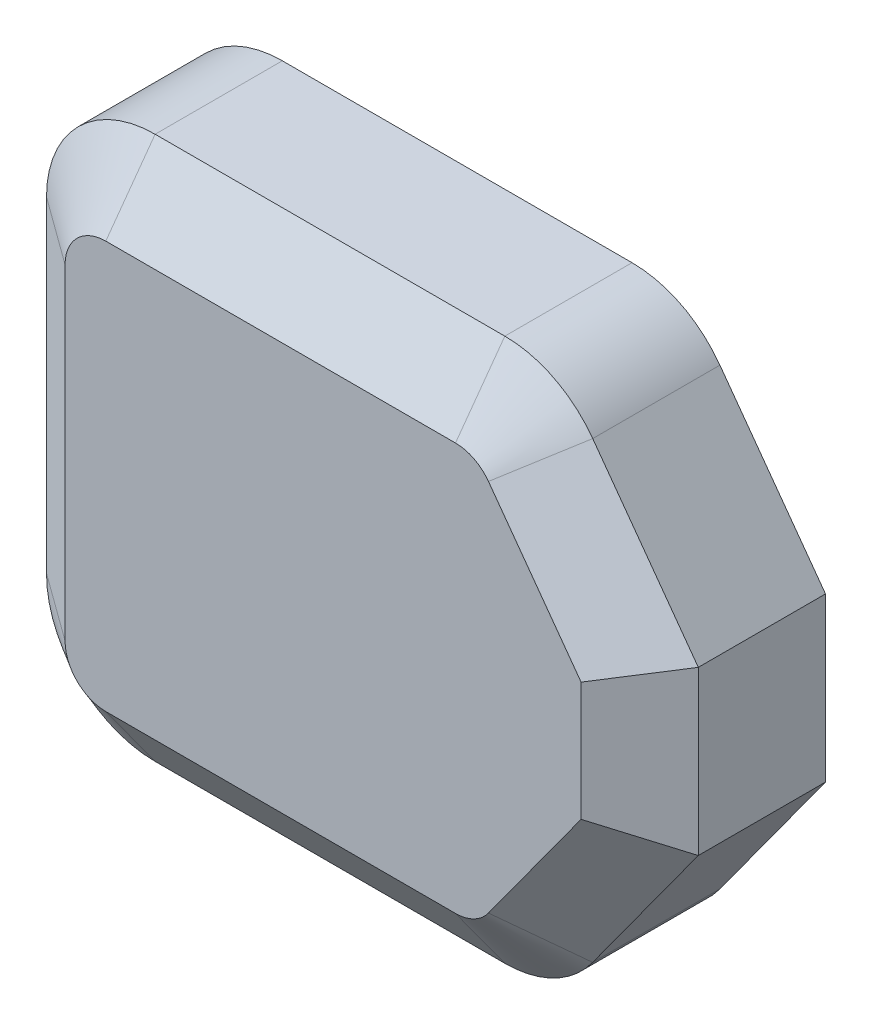
from build123d import *

# Parameters (mm, degrees)
ESQUISSE1_W        = 48
ESQUISSE1_H        = 40
BOSS_EXTRU_1_DEPTH = 13
CONG_1_R           = 8
CHANFREIN1_SIZE    = 14
CHANFREIN1_SIZE2   = 10.171595392
CONG_2_R           = 8
CHANFREIN2_SIZE    = 5
CHANFREIN2_SIZE2   = 3.63271264


with BuildPart() as part:
    # Esquisse1 → Boss.-Extru.1 (new body)
    with BuildSketch(Plane.XY):
        with Locations((24, 20)):
            Rectangle(ESQUISSE1_W, ESQUISSE1_H)
    extrude(amount=BOSS_EXTRU_1_DEPTH)

    # Congé1
    cong_1_edges = [part.edges().sort_by_distance(p)[0] for p in [
        (0, 40, 6.5),
        (0, 0, 6.5),
    ]]
    fillet(cong_1_edges, radius=CONG_1_R)

    # Chanfrein1
    chanfrein1_edges = [part.edges().sort_by_distance(p)[0] for p in [
        (48, 40, 6.5),
        (48, 0, 6.5),
    ]]
    chanfrein1_side = [part.faces().sort_by_distance(p)[0] for p in [
        (48, 20, 6.5),
    ]]
    chamfer(chanfrein1_edges, length=CHANFREIN1_SIZE, length2=CHANFREIN1_SIZE2, reference=chanfrein1_side[0])

    # Congé2
    cong_2_edges = [part.edges().sort_by_distance(p)[0] for p in [
        (37.828404608, 0, 6.5),
        (37.828404608, 40, 6.5),
    ]]
    fillet(cong_2_edges, radius=CONG_2_R)

    # Chanfrein2
    chanfrein2_edges = [part.edges().sort_by_distance(p)[0] for p in [
        (20.876100506, 0, 13),
        (0, 20, 13),
        (2.343145751, 37.656854249, 13),
        (2.343145751, 2.343145751, 13),
        (48, 20, 13),
        (44.112168483, 31.351141009, 13),
        (20.876100506, 40, 13),
        (44.112168483, 8.648858991, 13),
        (37.38412501, 0.871947806, 13),
        (37.38412501, 39.128052194, 13),
    ]]
    chanfrein2_side = [part.faces().sort_by_distance(p)[0] for p in [
        (22.630137731, 20, 13),
    ]]
    chamfer(chanfrein2_edges, length=CHANFREIN2_SIZE, length2=CHANFREIN2_SIZE2, reference=chanfrein2_side[0])


solid = part.part
